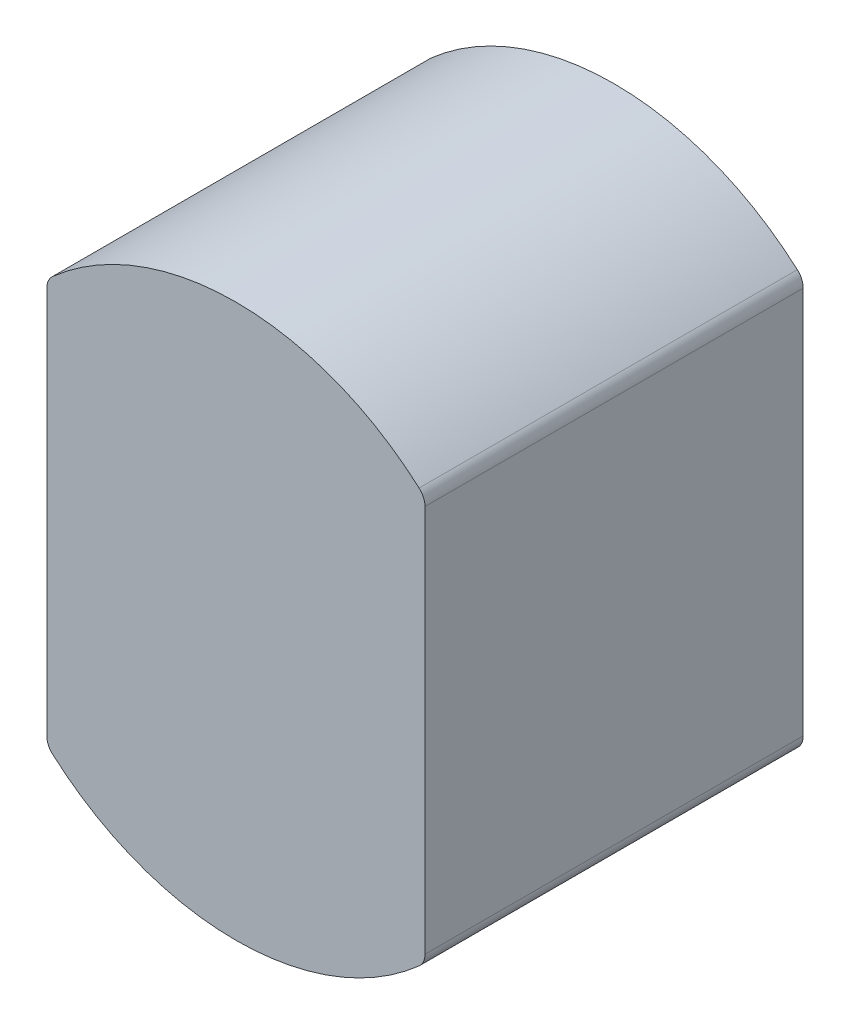
from build123d import *

# Parameters (mm, degrees)
SKETCH_1_W      = 65
SKETCH_1_H      = 69.282032302
EXTRUDE_1_DEPTH = 65
FILLET_2_R      = 3


with BuildPart() as part:
    # Эскиз1 → Бобышка-Вытянуть1 (new body)
    with BuildSketch(Plane.XY):
        with BuildLine():
            Line((-32.5, 34.641016151), (32.5, 34.641016151))
            ThreePointArc((32.5, 34.641016151), (0, 47.5), (-32.5, 34.641016151))
        make_face()
        Rectangle(SKETCH_1_W, SKETCH_1_H)
        with BuildLine():
            ThreePointArc((-32.5, -34.641016151), (0, -47.5), (32.5, -34.641016151))
            Line((32.5, -34.641016151), (-32.5, -34.641016151))
        make_face()
    extrude(amount=EXTRUDE_1_DEPTH)

    # Скругление2
    fillet_2_edges = [part.edges().sort_by_distance(p)[0] for p in [
        (32.5, 34.641016151, 32.5),
        (32.5, -34.641016151, 32.5),
        (-32.5, -34.641016151, 32.5),
        (-32.5, 34.641016151, 32.5),
    ]]
    fillet(fillet_2_edges, radius=FILLET_2_R)


solid = part.part
